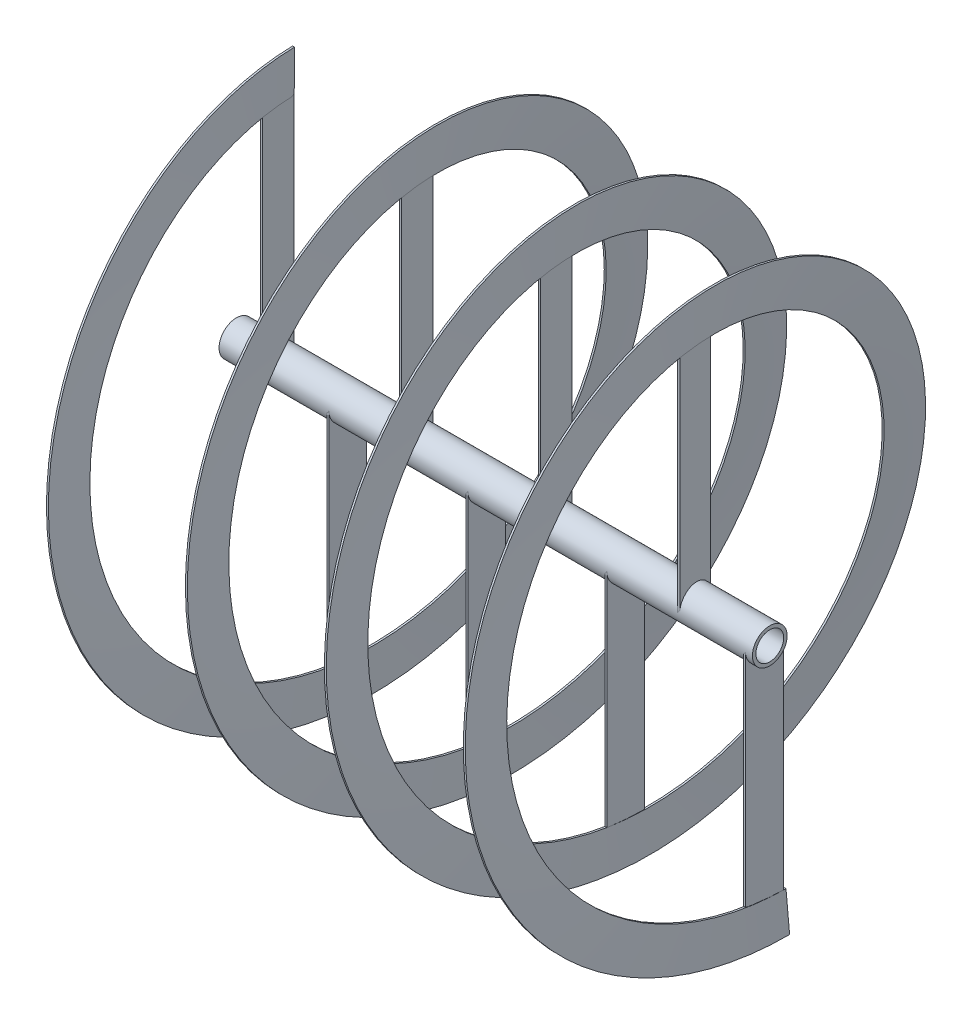
from build123d import *

# Parameters (mm, degrees)
ESBO_O1_R                            = 31.75
ESBO_O1_R_2                          = 25.4
RESSALTO_EXTRUS_O1_DEPTH             = 487.5
VARREDURA1_PITCH                     = 254
VARREDURA1_HEIGHT                    = 956
VARREDURA1_RADIUS                    = 482.6
VARREDURA1_START_ANGLE               = 180
ESBO_O4_W                            = 3.5
ESBO_O4_H                            = 76.2
SKETCH22_W                           = 3.5
SKETCH22_H                           = 63.5
BARRA_CHT_BR_CHT_3_5X2_5POL_1_DEPTH  = 406.4
SKETCH2_W                            = 3.5
SKETCH2_H                            = 63.5
BARRA_CHT_BR_CHT_3_5X2_5POL_3_DEPTH  = 406.4
SKETCH23_W                           = 3.5
SKETCH23_H                           = 63.5
BARRA_CHT_BR_CHT_3_5X2_5POL_4_DEPTH  = 406.4
SKETCH24_W                           = 3.5
SKETCH24_H                           = 63.5
BARRA_CHT_BR_CHT_3_5X2_5POL_5_DEPTH  = 406.4
SKETCH25_W                           = 3.5
SKETCH25_H                           = 63.5
BARRA_CHT_BR_CHT_3_5X2_5POL_6_DEPTH  = 406.4
SKETCH26_W                           = 3.5
SKETCH26_H                           = 63.5
BARRA_CHT_BR_CHT_3_5X2_5POL_7_DEPTH  = 406.4
SKETCH27_W                           = 3.5
SKETCH27_H                           = 63.5
BARRA_CHT_BR_CHT_3_5X2_5POL_8_DEPTH  = 406.4
SKETCH28_W                           = 3.5
SKETCH28_H                           = 63.5
BARRA_CHT_BR_CHT_3_5X2_5POL_10_DEPTH = 406.4
ESBO_O19_W                           = 600
ESBO_O19_H                           = 550
CORTE_EXTRUS_O2_DEPTH                = 112
ESBO_O20_R                           = 31.75
CORTE_EXTRUS_O3_DEPTH                = 1193


with BuildPart() as part:
    # Esboço1 → Ressalto-extrusão1 (new, symmetric)
    with BuildSketch(Plane(origin=(0, 0, 0), x_dir=(0, 0, -1), z_dir=(1, 0, 0))):
        Circle(ESBO_O1_R)
        Circle(ESBO_O1_R_2, mode=Mode.SUBTRACT)
    extrude(amount=RESSALTO_EXTRUS_O1_DEPTH, both=True)


with BuildPart() as body_2:
    # Varredura1: sweep along a helix
    with BuildLine() as varredura1_path:
        add(Helix(VARREDURA1_PITCH, VARREDURA1_HEIGHT, VARREDURA1_RADIUS, center=(-477.5, 0, 0), direction=(1, 0, 0), mode=Mode.PRIVATE).rotate(Axis((-477.5, 0, 0), (1, 0, 0)), VARREDURA1_START_ANGLE))
    # Esboço4 → Varredura1 (sweep)
    with BuildSketch(Plane(origin=(0, 0, 0), x_dir=(1, 0, 0), z_dir=(0, 1, 0))):
        with Locations((-475.75, 444.5)):
            Rectangle(ESBO_O4_W, ESBO_O4_H)
    sweep(path=varredura1_path.line, is_frenet=True)

    # Esboço19 → Corte-extrusão2 (cut)
    with BuildSketch(Plane(origin=(-500, 0, 0), x_dir=(0, 0, -1), z_dir=(1, 0, 0))):
        with Locations((331.781704214, 275)):
            Rectangle(ESBO_O19_W, ESBO_O19_H)
    extrude(amount=CORTE_EXTRUS_O2_DEPTH, mode=Mode.SUBTRACT)


with BuildPart() as body_3:
    # Sketch22 → Barra cht BR CHT 3.5X2.5POL(1) (new body)
    with BuildSketch(Plane(origin=(349.332273196, 406.4, 0), x_dir=(-0.9945218953682725, 0, 0.10452846326766124), z_dir=(0, -1, 0))):
        Rectangle(SKETCH22_W, SKETCH22_H)
    extrude(amount=BARRA_CHT_BR_CHT_3_5X2_5POL_1_DEPTH)


with BuildPart() as body_4:
    # Sketch2 → Barra cht BR CHT 3.5X2.5POL(3) (new body)
    with BuildSketch(Plane(origin=(222.361703637, -406.4, 0), x_dir=(-0.9961946980917447, 0, -0.08715574274766785), z_dir=(0, 1, 0))):
        Rectangle(SKETCH2_W, SKETCH2_H)
    extrude(amount=BARRA_CHT_BR_CHT_3_5X2_5POL_3_DEPTH)


with BuildPart() as body_5:
    # Sketch23 → Barra cht BR CHT 3.5X2.5POL(4) (new body)
    with BuildSketch(Plane(origin=(95.373157781, 406.4, 0), x_dir=(-0.9961946980917461, 0, 0.08715574274765149), z_dir=(0, -1, 0))):
        Rectangle(SKETCH23_W, SKETCH23_H)
    extrude(amount=BARRA_CHT_BR_CHT_3_5X2_5POL_4_DEPTH)


with BuildPart() as body_6:
    # Sketch24 → Barra cht BR CHT 3.5X2.5POL(5) (new body)
    with BuildSketch(Plane(origin=(-31.661633529, -406.4, 0), x_dir=(-0.9961946980917461, 0, -0.08715574274765156), z_dir=(0, 1, 0))):
        Rectangle(SKETCH24_W, SKETCH24_H)
    extrude(amount=BARRA_CHT_BR_CHT_3_5X2_5POL_5_DEPTH)


with BuildPart() as body_7:
    # Sketch25 → Barra cht BR CHT 3.5X2.5POL(6) (new body)
    with BuildSketch(Plane(origin=(-158.714190356, 406.4, 0), x_dir=(-0.9961946980917461, 0, 0.08715574274765156), z_dir=(0, -1, 0))):
        Rectangle(SKETCH25_W, SKETCH25_H)
    extrude(amount=BARRA_CHT_BR_CHT_3_5X2_5POL_6_DEPTH)


with BuildPart() as body_8:
    # Sketch26 → Barra cht BR CHT 3.5X2.5POL(7) (new body)
    with BuildSketch(Plane(origin=(-285.649958678, -406.4, 0), x_dir=(-0.9961946980917461, 0, -0.08715574274765156), z_dir=(0, 1, 0))):
        Rectangle(SKETCH26_W, SKETCH26_H)
    extrude(amount=BARRA_CHT_BR_CHT_3_5X2_5POL_7_DEPTH)


with BuildPart() as body_9:
    # Sketch27 → Barra cht BR CHT 3.5X2.5POL(8) (new body)
    with BuildSketch(Plane(origin=(-412.590169504, 406.4, 0), x_dir=(-0.9961946980917461, 0, 0.08715574274765156), z_dir=(0, -1, 0))):
        Rectangle(SKETCH27_W, SKETCH27_H)
    extrude(amount=BARRA_CHT_BR_CHT_3_5X2_5POL_8_DEPTH)


with BuildPart() as body_10:
    # Sketch28 → Barra cht BR CHT 3.5X2.5POL(10) (new body)
    with BuildSketch(Plane(origin=(476.352294583, -406.4, 0), x_dir=(-0.9945218953682741, 0, -0.10452846326764667), z_dir=(0, 1, 0))):
        Rectangle(SKETCH28_W, SKETCH28_H)
    extrude(amount=BARRA_CHT_BR_CHT_3_5X2_5POL_10_DEPTH)


with BuildPart() as corte_extrus_o3_tool:
    # Esboço20 → Corte-extrusão3 (new body)
    with BuildSketch(Plane(origin=(487.5, 0, 0), x_dir=(0, 0, -1), z_dir=(1, 0, 0))):
        Circle(ESBO_O20_R)
    extrude(amount=-CORTE_EXTRUS_O3_DEPTH)


with BuildPart() as body_3_1:
    add(body_3.part)

    # Corte-extrusão3: cut by corte_extrus_o3_tool
    add(corte_extrus_o3_tool.part, mode=Mode.SUBTRACT)


with BuildPart() as body_4_1:
    add(body_4.part)

    # Corte-extrusão3: cut by corte_extrus_o3_tool
    add(corte_extrus_o3_tool.part, mode=Mode.SUBTRACT)


with BuildPart() as body_5_1:
    add(body_5.part)

    # Corte-extrusão3: cut by corte_extrus_o3_tool
    add(corte_extrus_o3_tool.part, mode=Mode.SUBTRACT)


with BuildPart() as body_6_1:
    add(body_6.part)

    # Corte-extrusão3: cut by corte_extrus_o3_tool
    add(corte_extrus_o3_tool.part, mode=Mode.SUBTRACT)


with BuildPart() as body_7_1:
    add(body_7.part)

    # Corte-extrusão3: cut by corte_extrus_o3_tool
    add(corte_extrus_o3_tool.part, mode=Mode.SUBTRACT)


with BuildPart() as body_8_1:
    add(body_8.part)

    # Corte-extrusão3: cut by corte_extrus_o3_tool
    add(corte_extrus_o3_tool.part, mode=Mode.SUBTRACT)


with BuildPart() as body_9_1:
    add(body_9.part)

    # Corte-extrusão3: cut by corte_extrus_o3_tool
    add(corte_extrus_o3_tool.part, mode=Mode.SUBTRACT)


with BuildPart() as body_10_1:
    add(body_10.part)

    # Corte-extrusão3: cut by corte_extrus_o3_tool
    add(corte_extrus_o3_tool.part, mode=Mode.SUBTRACT)


solid = Compound([part.part, body_2.part, body_3_1.part, body_4_1.part, body_5_1.part, body_6_1.part, body_7_1.part, body_8_1.part, body_9_1.part, body_10_1.part])
